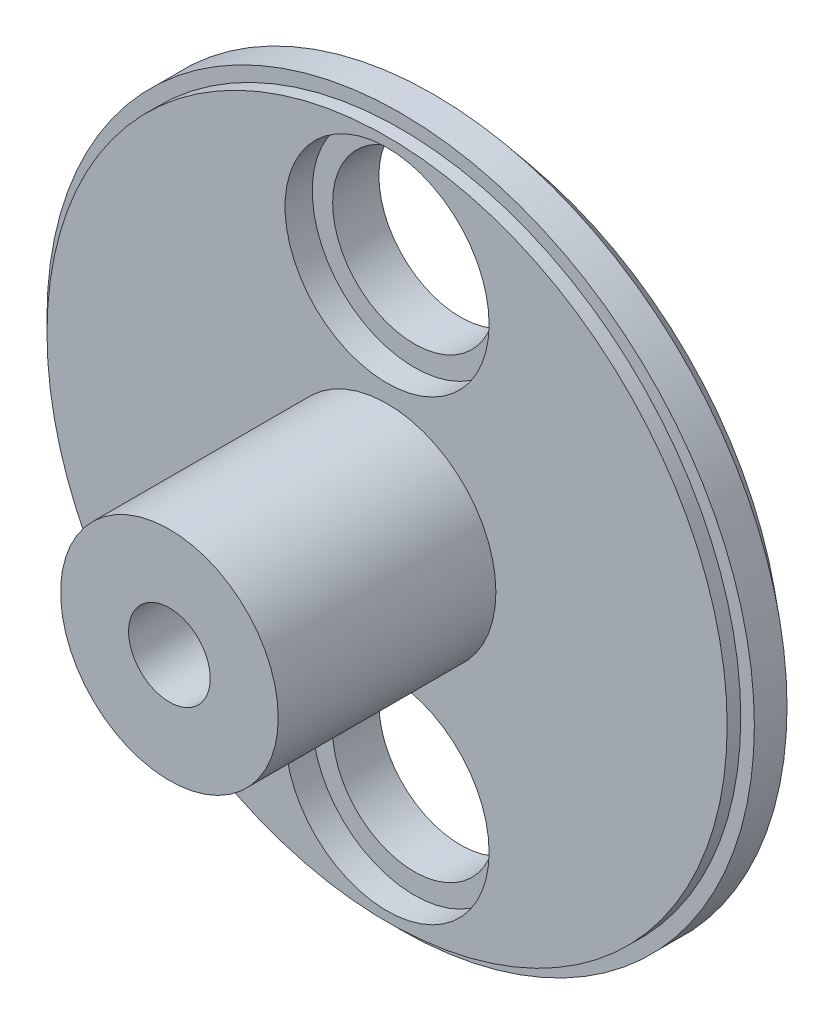
from build123d import *

# Parameters (mm, degrees)
ESQUISSE1_R             = 13
ESQUISSE1_R_2           = 3
BOSS_EXTRU_1_DEPTH      = 2.7
CHANFREIN1_SIZE         = 1
CHANFREIN1_SIZE2        = 1.191753593
ESQUISSE3_R             = 3.75
ENL_V_MAT_EXTRU_1_DEPTH = 1
ESQUISSE5_R             = 17.5
ESQUISSE5_R_2           = 12.5
ENL_V_MAT_EXTRU_3_DEPTH = 0.5
ESQUISSE7_R             = 4
BOSS_EXTRU_2_DEPTH      = 8
ESQUISSE8_R             = 1.5
ENL_V_MAT_EXTRU_5_DEPTH = 3


with BuildPart() as part:
    # Esquisse1 → Boss.-Extru.1 (new body)
    with BuildSketch(Plane.XY):
        Circle(ESQUISSE1_R)
        with Locations((0, -8.4)):
            Circle(ESQUISSE1_R_2, mode=Mode.SUBTRACT)
        with Locations((0, 8.4)):
            Circle(ESQUISSE1_R_2, mode=Mode.SUBTRACT)
    extrude(amount=BOSS_EXTRU_1_DEPTH)

    # Chanfrein1
    chanfrein1_edges = [part.edges().sort_by_distance(p)[0] for p in [
        (-13, 0, 0),
    ]]
    chanfrein1_side = [part.faces().sort_by_distance(p)[0] for p in [
        (-13, 0, 1.35),
    ]]
    chamfer(chanfrein1_edges, length=CHANFREIN1_SIZE, length2=CHANFREIN1_SIZE2, reference=chanfrein1_side[0])

    # Esquisse3 → Enlèv. mat.-Extru.1 (cut)
    with BuildSketch(Plane.XY.offset(2.7)):
        with Locations((0, 8.4)):
            Circle(ESQUISSE3_R)
        with Locations((0, -8.4)):
            Circle(ESQUISSE3_R)
    extrude(amount=-ENL_V_MAT_EXTRU_1_DEPTH, mode=Mode.SUBTRACT)

    # Esquisse5 → Enlèv. mat.-Extru.3 (cut)
    with BuildSketch(Plane.XY.offset(2.7)):
        Circle(ESQUISSE5_R)
        Circle(ESQUISSE5_R_2, mode=Mode.SUBTRACT)
    extrude(amount=-ENL_V_MAT_EXTRU_3_DEPTH, mode=Mode.SUBTRACT)

    # Esquisse7 → Boss.-Extru.2 (add)
    with BuildSketch(Plane.XY.offset(2.7)):
        Circle(ESQUISSE7_R)
    extrude(amount=BOSS_EXTRU_2_DEPTH)

    # Esquisse8 → Enlèv. mat.-Extru.5 (cut)
    with BuildSketch(Plane.XY.offset(10.7)):
        Circle(ESQUISSE8_R)
    extrude(amount=-ENL_V_MAT_EXTRU_5_DEPTH, mode=Mode.SUBTRACT)


solid = part.part
